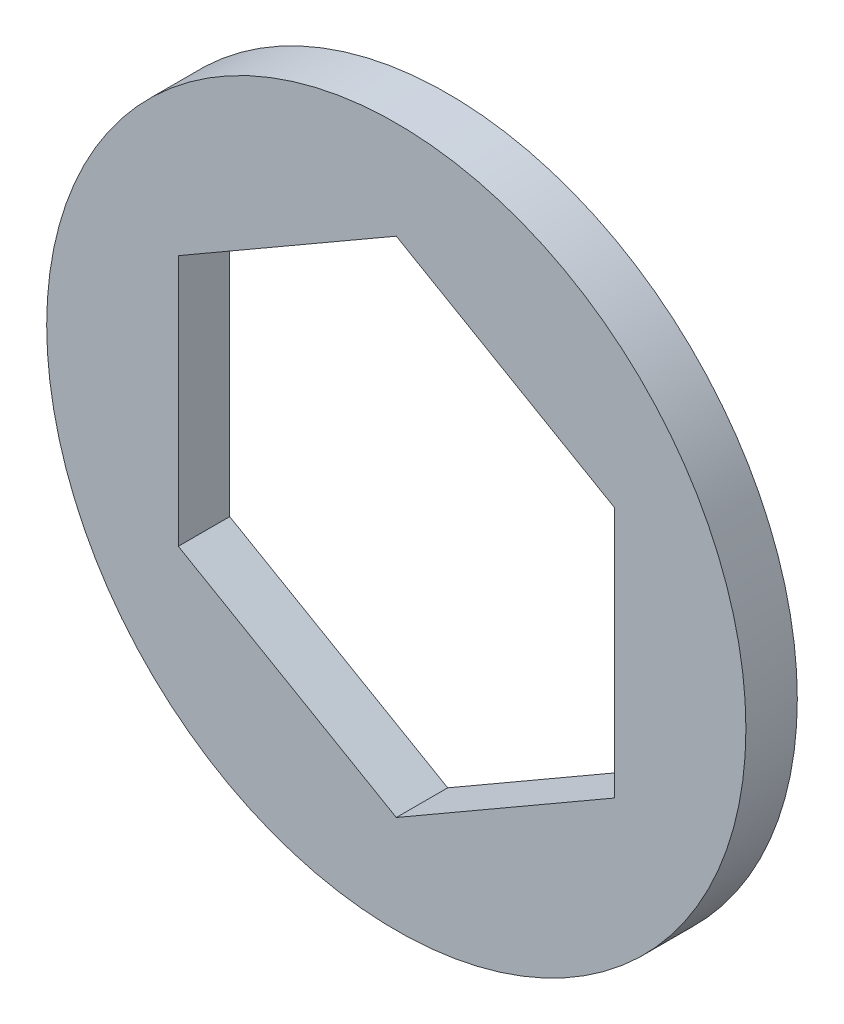
from build123d import *

# Parameters (mm, degrees)
SKETCH1_R           = 10.795
BOSS_EXTRUDE1_DEPTH = 1.5875


with BuildPart() as part:
    # Sketch1 → Boss-Extrude1 (new body)
    with BuildSketch(Plane.XY):
        Circle(SKETCH1_R)
        Polygon((0, 7.772289324), (-6.731, 3.886144662), (-6.731, -3.886144662), (0, -7.772289324), (6.731, -3.886144662), (6.731, 3.886144662), align=None, mode=Mode.SUBTRACT)
    extrude(amount=BOSS_EXTRUDE1_DEPTH)


solid = part.part
